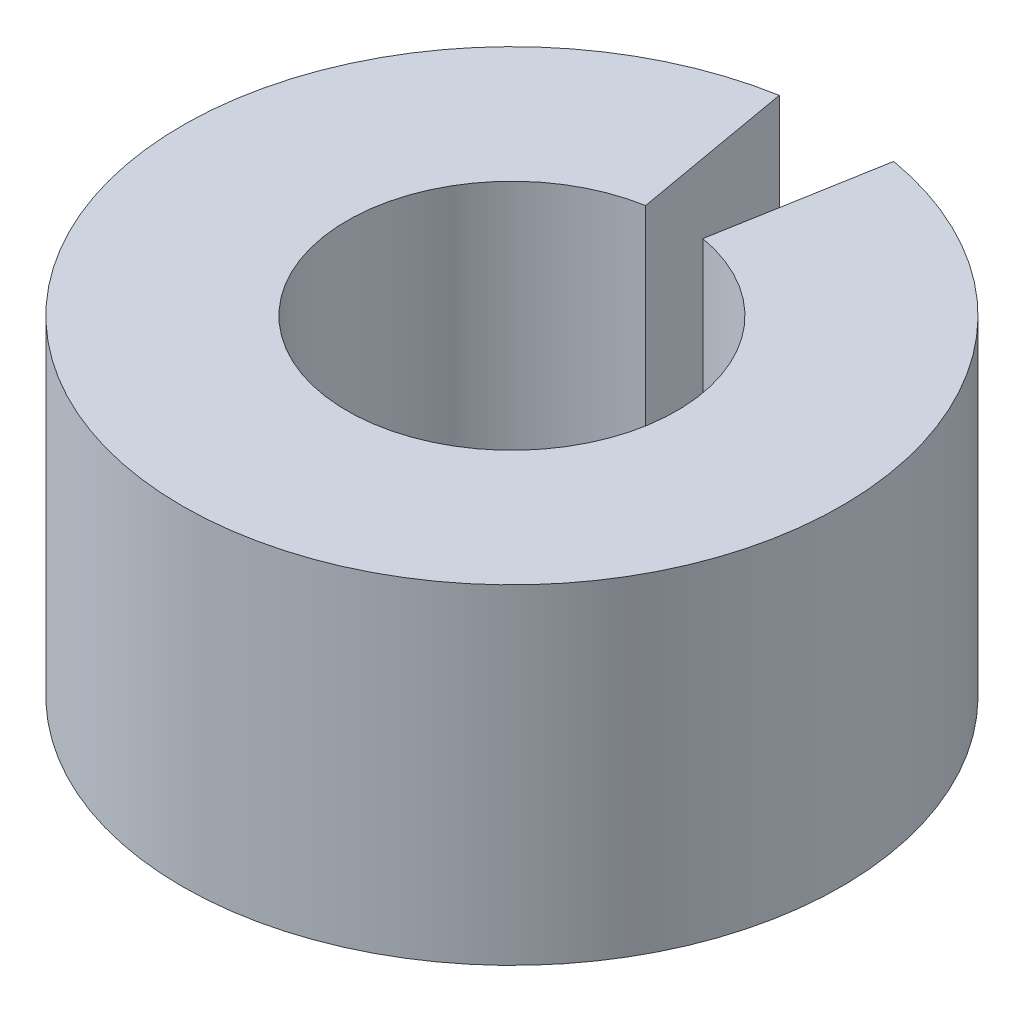
from build123d import *

# Parameters (mm, degrees)
BOSS_EXTRUDE1_DEPTH = 1


with BuildPart() as part:
    # Sketch1 → Boss-Extrude1 (new body)
    with BuildSketch(Plane(origin=(0, 0, 0), x_dir=(1, 0, 0), z_dir=(0, 1, 0))):
        with BuildLine():
            Line((0.086824089, 0.492403877), (0.173648178, 0.984807753))
            ThreePointArc((0.173648178, 0.984807753), (0, -1), (-0.173648178, 0.984807753))
            Line((-0.173648178, 0.984807753), (-0.086824089, 0.492403877))
            ThreePointArc((-0.086824089, 0.492403877), (0, -0.5), (0.086824089, 0.492403877))
        make_face()
    extrude(amount=BOSS_EXTRUDE1_DEPTH)


solid = part.part
